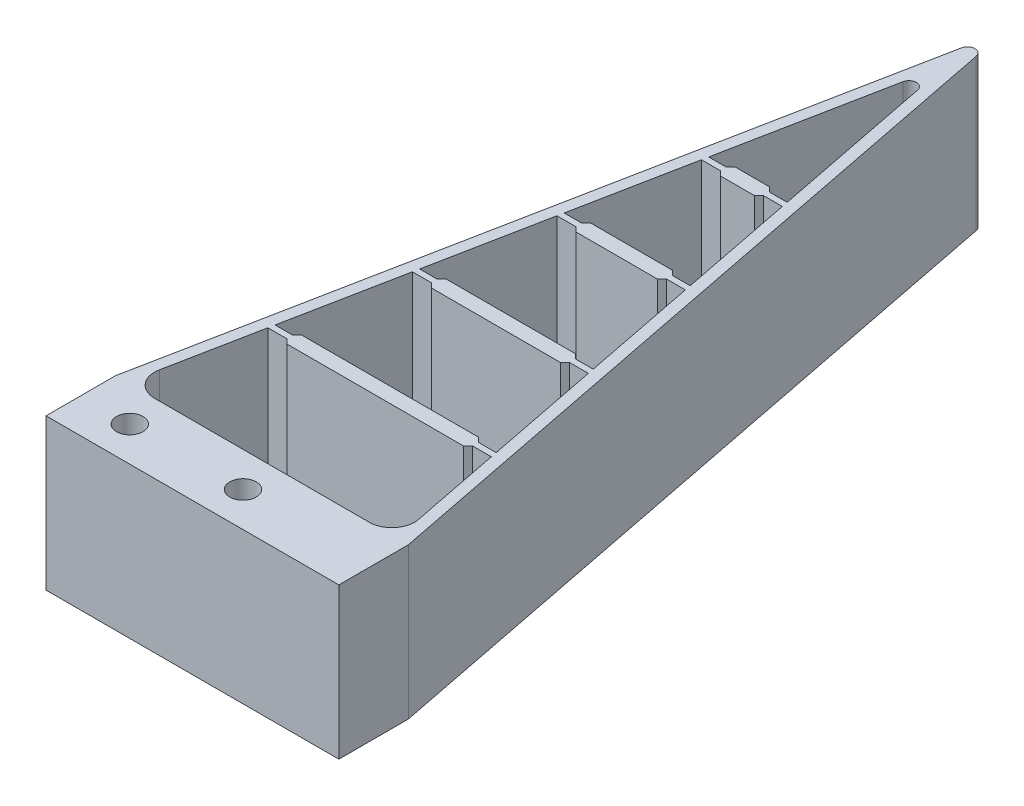
from build123d import *

# Parameters (mm, degrees)
BOSS_EXTRUDE1_DEPTH     = 10
FILLET1_R               = 0.987
CUT_EXTRUDE1_DEPTH      = 106.944642895
CUT_EXTRUDE1_DEPTH_BACK = 106.944642895
CUT_EXTRUDE2_DEPTH      = 108.351140461
CUT_EXTRUDE2_DEPTH_BACK = 108.351140461
SKETCH3_R               = 1.75
CUT_EXTRUDE3_DEPTH      = 106.944642895
CUT_EXTRUDE3_DEPTH_BACK = 106.944642895
FILLET2_R               = 3


with BuildPart() as part:
    # Sketch1 → Boss-Extrude1 (new, symmetric)
    with BuildSketch(Plane(origin=(0, 0, 0), x_dir=(1, 0, 0), z_dir=(0, 1, 0))):
        Polygon((-19.4, 0), (19.4, 0), (19.4, 9.2), (0, 107.797571926), (-19.4, 9.2), align=None)
    extrude(amount=BOSS_EXTRUDE1_DEPTH, both=True)

    # Fillet1
    fillet1_edges = [part.edges().sort_by_distance(p)[0] for p in [
        (0, 0, -107.797571926),
    ]]
    fillet(fillet1_edges, radius=FILLET1_R)

    # Sketch2 → Cut-Extrude1 (cut, two sides: drawn at the far end of the back side and taken through both)
    with BuildSketch(Plane(origin=(0, 0, 0), x_dir=(1, 0, 0), z_dir=(0, 1, 0)).offset(-CUT_EXTRUDE1_DEPTH_BACK)):
        Polygon((-14.919848876, 24.2), (-17.871240013, 9.2), (17.871240013, 9.2), (14.919848876, 24.2), align=None)
        Polygon((-11.771698328, 40.2), (-14.526330057, 26.2), (14.526330057, 26.2), (11.771698328, 40.2), align=None)
        Polygon((-8.623547781, 56.2), (-11.37817951, 42.2), (11.37817951, 42.2), (8.623547781, 56.2), align=None)
        Polygon((-5.475397234, 72.2), (-8.230028963, 58.2), (8.230028963, 58.2), (5.475397234, 72.2), align=None)
        with BuildLine():
            Line((-0.966469566, 95.115944337), (-5.081878416, 74.2))
            Line((-5.081878416, 74.2), (5.081878416, 74.2))
            Line((5.081878416, 74.2), (0.966469566, 95.115944337))
            ThreePointArc((0.966469566, 95.115944337), (0, 95.910782356), (-0.966469566, 95.115944337))
        make_face()
    extrude(amount=CUT_EXTRUDE1_DEPTH + CUT_EXTRUDE1_DEPTH_BACK, mode=Mode.SUBTRACT)

    # Sketch3 → Cut-Extrude2 (cut, two sides: drawn at the far end of the back side and taken through both)
    with BuildSketch(Plane(origin=(0, 10, 0), x_dir=(1, 0, 0), z_dir=(0, 1, 0)).offset(-CUT_EXTRUDE2_DEPTH_BACK)):
        with Locations(Location((-12.9, 4.6, 0), (0, 0, 270))):
            Circle(SKETCH3_R)
        with Locations(Location((2.1, 4.6, 0), (0, 0, 270))):
            Circle(SKETCH3_R)
    extrude(amount=CUT_EXTRUDE2_DEPTH + CUT_EXTRUDE2_DEPTH_BACK, mode=Mode.SUBTRACT)

    # Sketch4 → Cut-Extrude3 (cut, two sides: drawn at the far end of the back side and taken through both)
    with BuildSketch(Plane(origin=(0, 0, 0), x_dir=(1, 0, 0), z_dir=(0, 1, 0)).offset(-CUT_EXTRUDE3_DEPTH_BACK)):
        Polygon((14.919848876, 24.2), (14.80179323, 24.8), (12.30179323, 24.8), (11.70179323, 24.2), align=None)
        Polygon((14.644385703, 25.6), (14.526330057, 26.2), (11.70179323, 26.2), (12.30179323, 25.6), align=None)
        Polygon((-12.30179323, 25.6), (-11.70179323, 26.2), (-14.526330057, 26.2), (-14.644385703, 25.6), align=None)
        Polygon((-12.30179323, 24.8), (-14.80179323, 24.8), (-14.919848876, 24.2), (-11.70179323, 24.2), align=None)
        Polygon((-11.37817951, 42.2), (-11.496235156, 41.6), (-9.153642683, 41.6), (-8.553642683, 42.2), align=None)
        Polygon((-11.771698328, 40.2), (-8.553642683, 40.2), (-9.153642683, 40.8), (-11.653642683, 40.8), align=None)
        Polygon((8.553642683, 40.2), (11.771698328, 40.2), (11.653642683, 40.8), (9.153642683, 40.8), align=None)
        Polygon((9.153642683, 41.6), (11.496235156, 41.6), (11.37817951, 42.2), (8.553642683, 42.2), align=None)
        Polygon((5.405492136, 56.2), (8.623547781, 56.2), (8.505492136, 56.8), (6.005492136, 56.8), align=None)
        Polygon((6.005492136, 57.6), (8.348084609, 57.6), (8.230028963, 58.2), (5.405492136, 58.2), align=None)
        Polygon((-8.230028963, 58.2), (-8.348084609, 57.6), (-6.005492136, 57.6), (-5.405492136, 58.2), align=None)
        Polygon((-8.623547781, 56.2), (-5.405492136, 56.2), (-6.005492136, 56.8), (-8.505492136, 56.8), align=None)
        Polygon((2.257341589, 72.2), (5.475397234, 72.2), (5.357341589, 72.8), (2.857341589, 72.8), align=None)
        Polygon((2.857341589, 73.6), (5.199934061, 73.6), (5.081878416, 74.2), (2.257341589, 74.2), align=None)
        Polygon((-5.081878416, 74.2), (-5.199934061, 73.6), (-2.857341589, 73.6), (-2.257341589, 74.2), align=None)
        Polygon((-5.475397234, 72.2), (-2.257341589, 72.2), (-2.857341589, 72.8), (-5.357341589, 72.8), align=None)
    extrude(amount=CUT_EXTRUDE3_DEPTH + CUT_EXTRUDE3_DEPTH_BACK, mode=Mode.SUBTRACT)

    # Fillet2
    fillet2_edges = [part.edges().sort_by_distance(p)[0] for p in [
        (17.871240013, 0, -9.2),
        (-17.871240013, 0, -9.2),
    ]]
    fillet(fillet2_edges, radius=FILLET2_R)


solid = part.part
